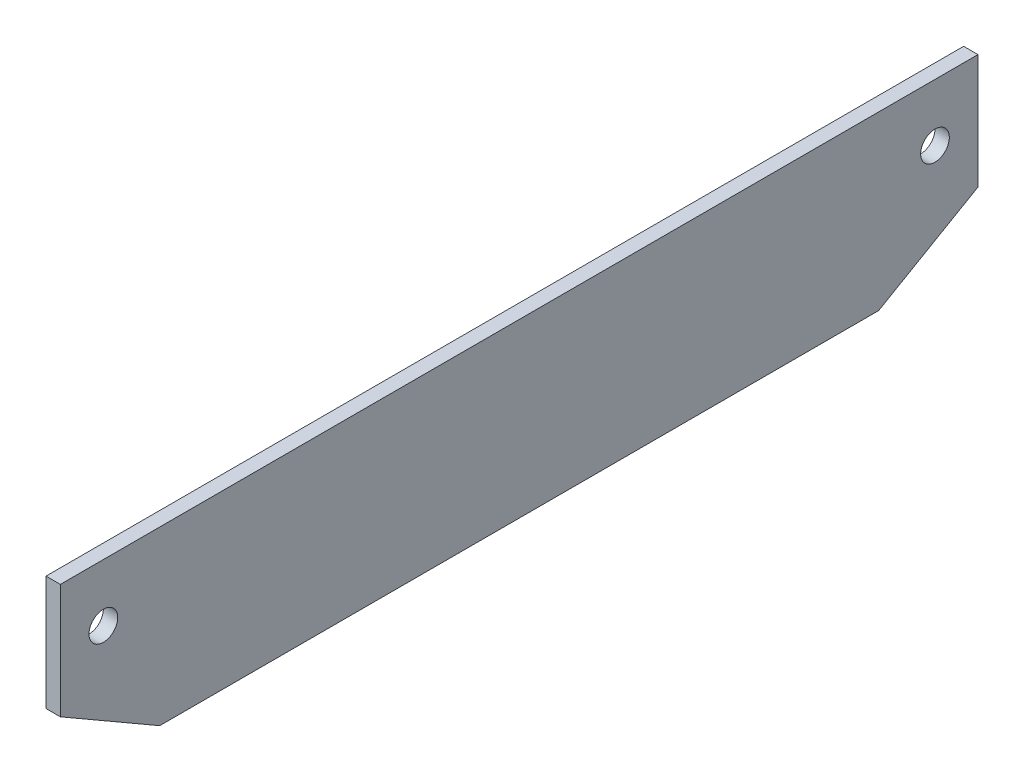
from build123d import *

# Parameters (mm, degrees)
SKETCH1_R           = 3.175
BOSS_EXTRUDE1_DEPTH = 3.175


with BuildPart() as part:
    # Sketch1 → Boss-Extrude1 (new body)
    with BuildSketch(Plane(origin=(0, 0, 0), x_dir=(0, 0, -1), z_dir=(1, 0, 0))):
        Polygon((-101.6, -12.7), (-101.6, 12.7), (101.6, 12.7), (101.6, -12.7), (79.602954744, -25.4), (-79.602954744, -25.4), align=None)
        with Locations((-92.075, 0)):
            Circle(SKETCH1_R, mode=Mode.SUBTRACT)
        with Locations((92.075, 0)):
            Circle(SKETCH1_R, mode=Mode.SUBTRACT)
    extrude(amount=BOSS_EXTRUDE1_DEPTH)


solid = part.part
